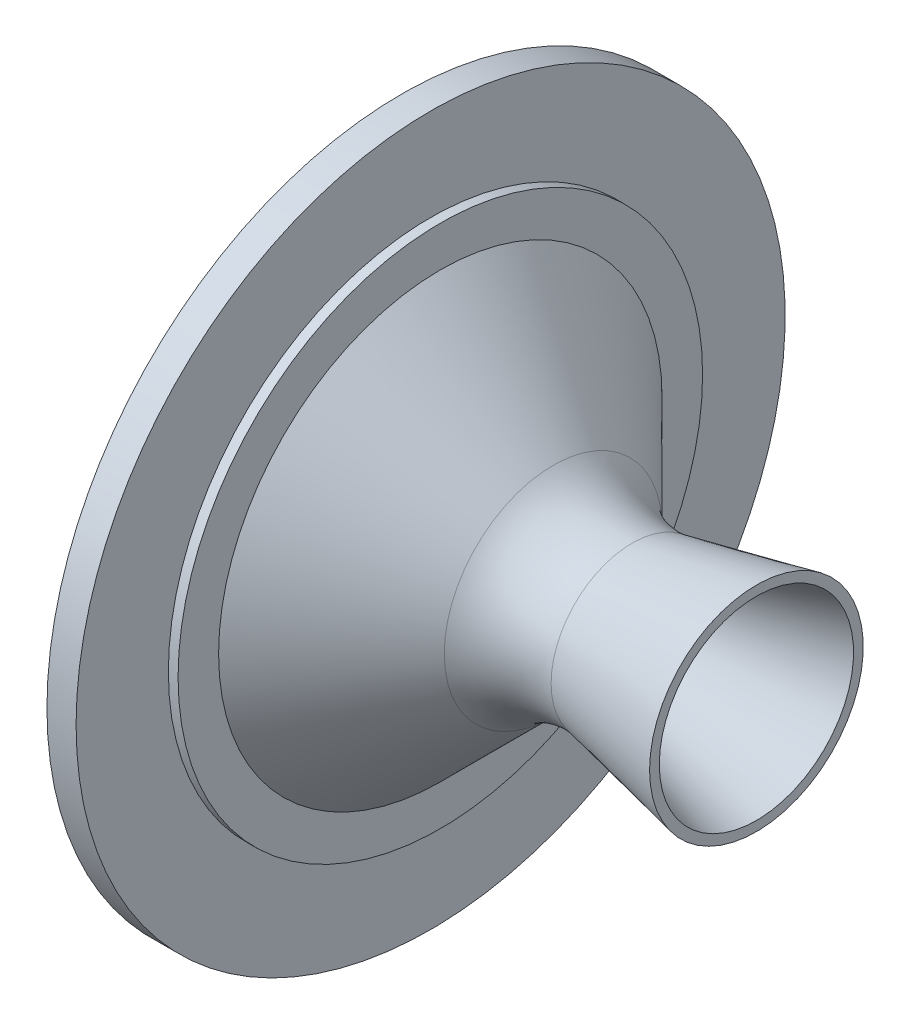
from build123d import *


with BuildPart() as part:
    # Esboço2 → revolução (revolve)
    with BuildSketch(Plane.XY, mode=Mode.PRIVATE) as revolu_o_sk:
        with BuildLine():
            Line((-38.630060783, 24), (-36.630060783, 24))
            Line((-36.630060783, 24), (-36.630060783, 22))
            Line((-36.630060783, 22), (-19.529700637, 4.9))
            Line((-19.529700637, 4.9), (-2.089060783, 10))
            Line((-2.089060783, 10), (-2.089060783, 11))
            Line((-2.089060783, 11), (-14.880094771, 8.343395867))
            ThreePointArc((-14.880094771, 8.343395867), (-19.272729764, 8.856141459), (-23.014659232, 11.21328254))
            Line((-23.014659232, 11.21328254), (-34.630060783, 22.828439462))
            Line((-34.630060783, 22.828439462), (-34.630060783, 27))
            Line((-34.630060783, 27), (-35.630060783, 27))
            Line((-35.630060783, 27), (-35.630060783, 36.5))
            Line((-35.630060783, 36.5), (-38.630060783, 36.5))
            Line((-38.630060783, 36.5), (-38.630060783, 24))
        make_face()
    revolve(revolu_o_sk.sketch.rotate(Axis((-109.349560783, 0, 0), (1, 0, 0)), 90), axis=Axis((-109.349560783, 0, 0), (1, 0, 0)))


solid = part.part
